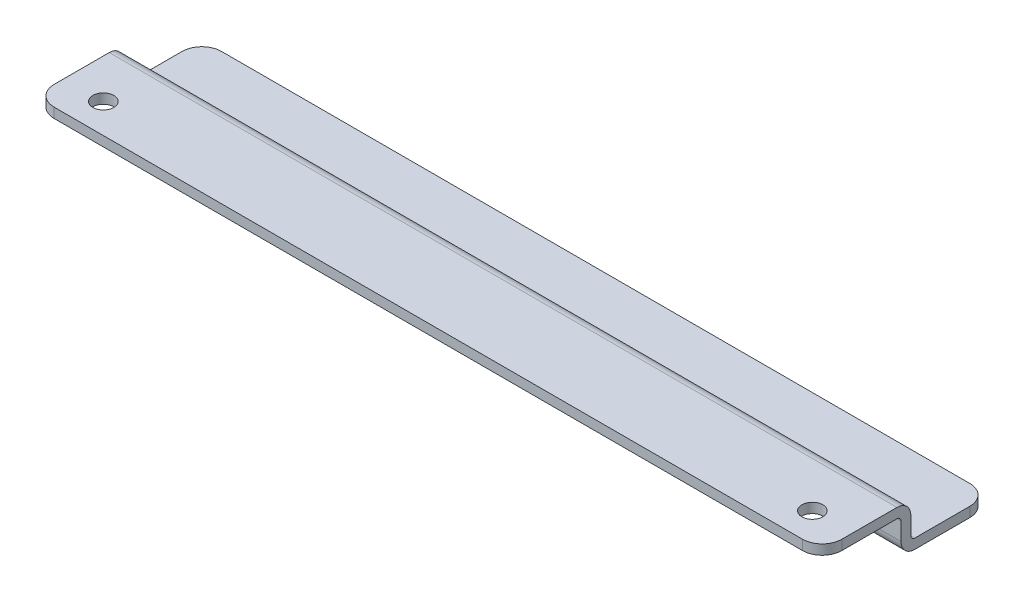
from build123d import *

# Parameters (mm, degrees)
BOSS_EXTRUDE1_DEPTH              = 254
FILLET1_R                        = 1.27
FILLET2_R                        = 4.445
F_17_64_0_26563_DIAMETER_HOLE1_D = 6.747002
FILLET3_R                        = 6.35


with BuildPart() as part:
    # Sketch1 → Boss-Extrude1 (new body)
    with BuildSketch(Plane(origin=(0, 0, 0), x_dir=(0, 0, -1), z_dir=(1, 0, 0))):
        Polygon((0, 0), (28.575, 0), (28.575, -11.43), (53.975, -11.43), (53.975, -14.605), (25.4, -14.605), (25.4, -3.175), (0, -3.175), align=None)
    extrude(amount=BOSS_EXTRUDE1_DEPTH)

    # Fillet1
    fillet1_edges = [part.edges().sort_by_distance(p)[0] for p in [
        (127, -11.43, -28.575),
        (127, -3.175, -25.4),
    ]]
    fillet(fillet1_edges, radius=FILLET1_R)

    # Fillet2
    fillet2_edges = [part.edges().sort_by_distance(p)[0] for p in [
        (127, 0, -28.575),
        (127, -14.605, -25.4),
    ]]
    fillet(fillet2_edges, radius=FILLET2_R)

    # 17/64 (0.26563) Diameter Hole1 (through all)
    with Locations(Plane(origin=(0, 0, 0), x_dir=(1, 0, 0), z_dir=(0, 1, 0))):
        with Locations((241.3, 9.525), (12.7, 9.525)):
            Hole(F_17_64_0_26563_DIAMETER_HOLE1_D / 2)

    # Fillet3
    fillet3_edges = [part.edges().sort_by_distance(p)[0] for p in [
        (0, -1.5875, 0),
        (254, -13.0175, -53.975),
        (254, -1.5875, 0),
        (0, -13.0175, -53.975),
    ]]
    fillet(fillet3_edges, radius=FILLET3_R)


solid = part.part
